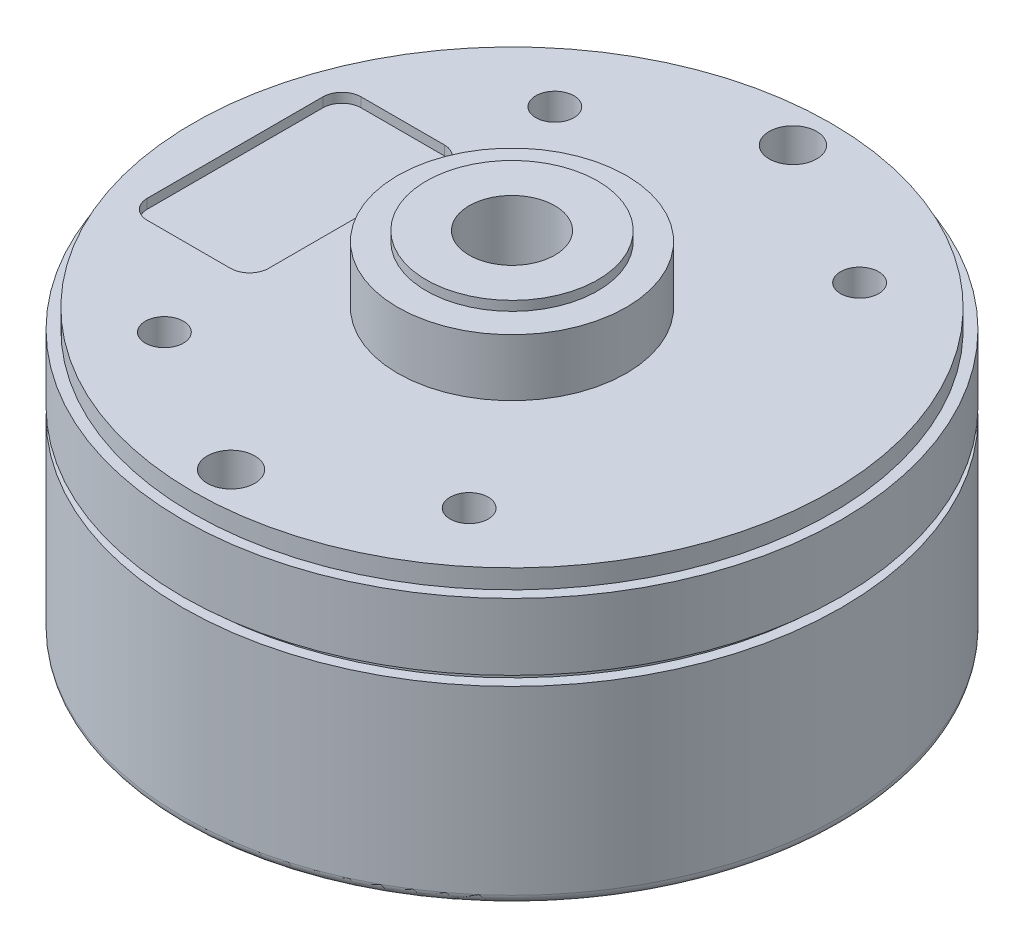
from build123d import *

# Parameters (mm, degrees)
FILLET_1_R          = 0.5
SKETCH_2_R          = 1
SKETCH_2_R_2        = 1.25
CUT_EXTRUDE_1_DEPTH = 4
SKETCH_3_R          = 1
SKETCH_3_R_2        = 1.25
CUT_EXTRUDE_2_DEPTH = 4
SKETCH_4_R          = 3.2
CUT_EXTRUDE_3_DEPTH = 1
CUT_EXTRUDE_4_DEPTH = 0.5


with BuildPart() as part:
    # 草图1 → 旋转1 (revolve)
    with BuildSketch(Plane.XY, mode=Mode.PRIVATE) as revolve_1_sk:
        Polygon((2.25, 0), (2.25, 18.5), (4.5, 18.5), (4.5, 18), (6, 18), (6, 15), (16.75, 15), (16.75, 14), (17.3, 14), (17.3, 10.5), (16.75, 10.5), (16.75, 10), (17.3, 10), (17.3, 0), align=None)
    revolve(revolve_1_sk.sketch.rotate(Axis((0, 0, 0), (0, 1, 0)), 90), axis=Axis((0, 0, 0), (0, 1, 0)))

    # 圆角1
    fillet_1_edges = [part.edges().sort_by_distance(p)[0] for p in [
        (0, 0, 17.3),
    ]]
    fillet(fillet_1_edges, radius=FILLET_1_R)

    # 草图2 → 切除-拉伸1 (cut)
    with BuildSketch(Plane(origin=(0, 15, 0), x_dir=(1, 0, 0), z_dir=(0, 1, 0))):
        with Locations(Location((-8, 10.25, 0), (0, 0, 270))):
            Circle(SKETCH_2_R)
        with Locations(Location((8, 10.25, 0), (0, 0, 270))):
            Circle(SKETCH_2_R)
        with Locations(Location((8, -10.25, 0), (0, 0, 270))):
            Circle(SKETCH_2_R)
        with Locations(Location((-8, -10.25, 0), (0, 0, 270))):
            Circle(SKETCH_2_R)
        with Locations(Location((0, 14.75, 0), (0, 0, 270))):
            Circle(SKETCH_2_R_2)
        with Locations(Location((0, -14.75, 0), (0, 0, 90))):
            Circle(SKETCH_2_R_2)
    extrude(amount=-CUT_EXTRUDE_1_DEPTH, mode=Mode.SUBTRACT)

    # 草图3 → 切除-拉伸2 (cut)
    with BuildSketch(Plane.XZ):
        with Locations(Location((0, 6.25, 0), (0, 0, 270))):
            Circle(SKETCH_3_R)
        with Locations(Location((5.25, 5.25, 0), (0, 0, 270))):
            Circle(SKETCH_3_R_2)
        with Locations(Location((6.25, 0, 0), (0, 0, 270))):
            Circle(SKETCH_3_R)
        with Locations(Location((5.25, -5.25, 0), (0, 0, 270))):
            Circle(SKETCH_3_R_2)
        with Locations(Location((0, -6.25, 0), (0, 0, 270))):
            Circle(SKETCH_3_R)
        with Locations(Location((-5.25, -5.25, 0), (0, 0, 270))):
            Circle(SKETCH_3_R_2)
        with Locations(Location((-6.25, 0, 0), (0, 0, 270))):
            Circle(SKETCH_3_R)
        with Locations(Location((-5.25, 5.25, 0), (0, 0, 270))):
            Circle(SKETCH_3_R_2)
    extrude(amount=-CUT_EXTRUDE_2_DEPTH, mode=Mode.SUBTRACT)

    # 草图4 → 切除-拉伸3 (cut)
    with BuildSketch(Plane.XZ):
        with Locations(Location((0, 0, 0), (0, 0, 270))):
            Circle(SKETCH_4_R)
    extrude(amount=-CUT_EXTRUDE_3_DEPTH, mode=Mode.SUBTRACT)

    # 草图5 → 切除-拉伸4 (cut)
    with BuildSketch(Plane(origin=(0, 15, 0), x_dir=(1, 0, 0), z_dir=(0, 1, 0))):
        with BuildLine():
            Line((-13.538235609, -5.613985367), (-9.165063111, -5.613985367))
            ThreePointArc((-9.165063111, -5.613985367), (-8.45795633, -5.321092149), (-8.165063111, -4.613985367))
            Line((-8.165063111, -4.613985367), (-8.165063111, 4.613985367))
            ThreePointArc((-8.165063111, 4.613985367), (-8.45795633, 5.321092149), (-9.165063111, 5.613985367))
            Line((-9.165063111, 5.613985367), (-13.538235609, 5.613985367))
            ThreePointArc((-13.538235609, 5.613985367), (-14.245342391, 5.321092149), (-14.538235609, 4.613985367))
            Line((-14.538235609, 4.613985367), (-14.538235609, -4.613985367))
            ThreePointArc((-14.538235609, -4.613985367), (-14.245342391, -5.321092149), (-13.538235609, -5.613985367))
        make_face()
    extrude(amount=-CUT_EXTRUDE_4_DEPTH, mode=Mode.SUBTRACT)


solid = part.part
